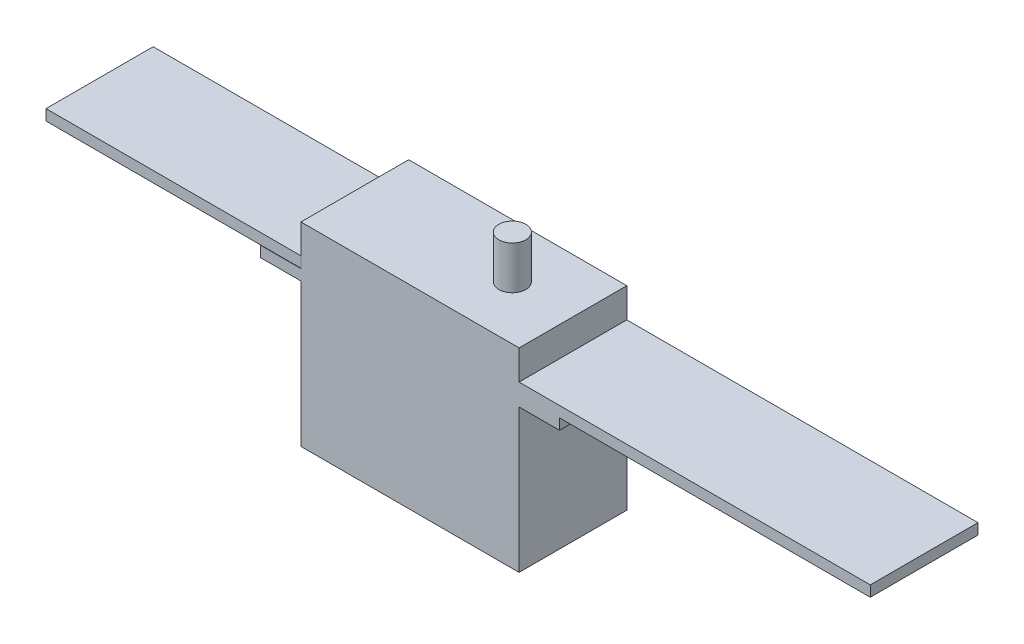
from build123d import *

# Parameters (mm, degrees)
SKETCH1_W                = 40.5
SKETCH1_H                = 20
BOSS_EXTRUDE1_DEPTH      = 36.1
SKETCH2_R                = 2.5
BOSS_EXTRUDE2_DEPTH      = 8
BOSS_EXTRUDE3_DEPTH      = 7.5
BOSS_EXTRUDE3_DEPTH_BACK = 48
SKETCH3_W                = 20
SKETCH3_H                = 2
SKETCH4_R                = 2
CUT_EXTRUDE1_DEPTH       = 7.5
SKETCH5_W                = 47.383386501
SKETCH5_H                = 19.900048315
SKETCH5_W_2              = 65.196690676
SKETCH5_H_2              = 19.999647671
BOSS_EXTRUDE4_DEPTH      = 2


with BuildPart() as part:
    # Sketch1 → Boss-Extrude1 (new body)
    with BuildSketch(Plane(origin=(0, 0, 0), x_dir=(1, 0, 0), z_dir=(0, 1, 0))):
        with Locations((3.506737992, 0.753901676)):
            Rectangle(SKETCH1_W, SKETCH1_H)
    extrude(amount=BOSS_EXTRUDE1_DEPTH)

    # Sketch2 → Boss-Extrude2 (add)
    with BuildSketch(Plane(origin=(0, 36.1, 0), x_dir=(1, 0, 0), z_dir=(0, 1, 0))):
        with Locations(Location((12.506737992, 0.753901676, 0), (0, 0, 270))):
            Circle(SKETCH2_R)
    extrude(amount=BOSS_EXTRUDE2_DEPTH)

    # Sketch3 → Boss-Extrude3 (add, two sides: drawn at the far end of the back side and taken through both)
    with BuildSketch(Plane.ZY.offset(16.743262008).offset(-BOSS_EXTRUDE3_DEPTH_BACK)):
        with Locations((-0.753901676, 27.6)):
            Rectangle(SKETCH3_W, SKETCH3_H)
    extrude(amount=BOSS_EXTRUDE3_DEPTH + BOSS_EXTRUDE3_DEPTH_BACK)

    # Sketch4 → Cut-Extrude1 (cut)
    with BuildSketch(Plane(origin=(0, 28.6, 0), x_dir=(1, 0, 0), z_dir=(0, 1, 0))):
        with Locations(Location((-20.493262008, 5.753901676, 0), (0, 0, 270))):
            Circle(SKETCH4_R)
        with Locations(Location((27.506737992, 5.753901676, 0), (0, 0, 270))):
            Circle(SKETCH4_R)
        with Locations(Location((-20.493262008, -4.246098324, 0), (0, 0, 270))):
            Circle(SKETCH4_R)
        with Locations(Location((27.506737992, -4.246098324, 0), (0, 0, 270))):
            Circle(SKETCH4_R)
    extrude(amount=-CUT_EXTRUDE1_DEPTH, mode=Mode.SUBTRACT)

    # Sketch5 → Boss-Extrude4 (add)
    with BuildSketch(Plane(origin=(0, 28.6, 0), x_dir=(1, 0, 0), z_dir=(0, 1, 0))):
        with Locations((-40.434955259, 0.760670561)):
            Rectangle(SKETCH5_W, SKETCH5_H)
        with Locations((56.35508333, 0.753725511)):
            Rectangle(SKETCH5_W_2, SKETCH5_H_2)
    extrude(amount=BOSS_EXTRUDE4_DEPTH)


solid = part.part
